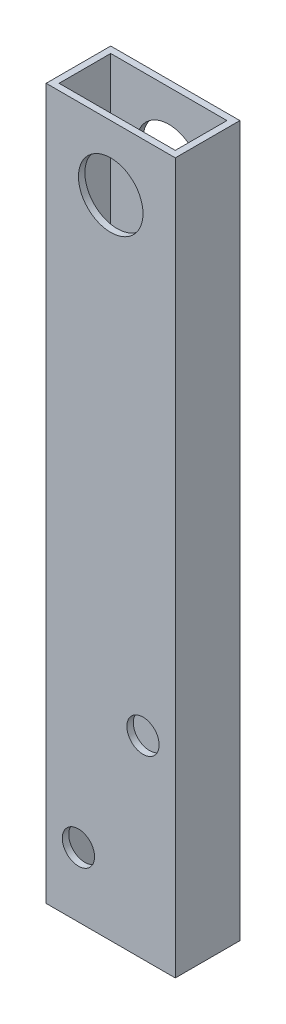
from build123d import *

# Parameters (mm, degrees)
SKETCH1_W           = 50.8
SKETCH1_H           = 25.4
SKETCH1_W_2         = 45.72
SKETCH1_H_2         = 20.32
BOSS_EXTRUDE1_DEPTH = 279.4
SKETCH2_R           = 6.35
SKETCH2_R_2         = 12.7
CUT_EXTRUDE1_DEPTH  = 286.114292872
SKETCH3_R           = 6.35
CUT_EXTRUDE2_DEPTH  = 286.114292872


with BuildPart() as part:
    # Sketch1 → Boss-Extrude1 (new body)
    with BuildSketch(Plane(origin=(0, 0, 0), x_dir=(1, 0, 0), z_dir=(0, 1, 0))):
        with Locations((25.4, 12.7)):
            Rectangle(SKETCH1_W, SKETCH1_H)
        with Locations((25.4, 12.7)):
            Rectangle(SKETCH1_W_2, SKETCH1_H_2, mode=Mode.SUBTRACT)
    extrude(amount=BOSS_EXTRUDE1_DEPTH)

    # Sketch2 → Cut-Extrude1 (cut, through all)
    with BuildSketch(Plane.XY):
        with Locations((12.7, 25.4)):
            Circle(SKETCH2_R)
        with Locations((25.4, 254)):
            Circle(SKETCH2_R_2)
    extrude(amount=-CUT_EXTRUDE1_DEPTH, mode=Mode.SUBTRACT)

    # Sketch3 → Cut-Extrude2 (cut, through all)
    with BuildSketch(Plane(origin=(0, 0, -25.4), x_dir=(-1, 0, 0), z_dir=(0, 0, -1))):
        with Locations((-38.1, 76.2)):
            Circle(SKETCH3_R)
    extrude(amount=-CUT_EXTRUDE2_DEPTH, mode=Mode.SUBTRACT)


solid = part.part
